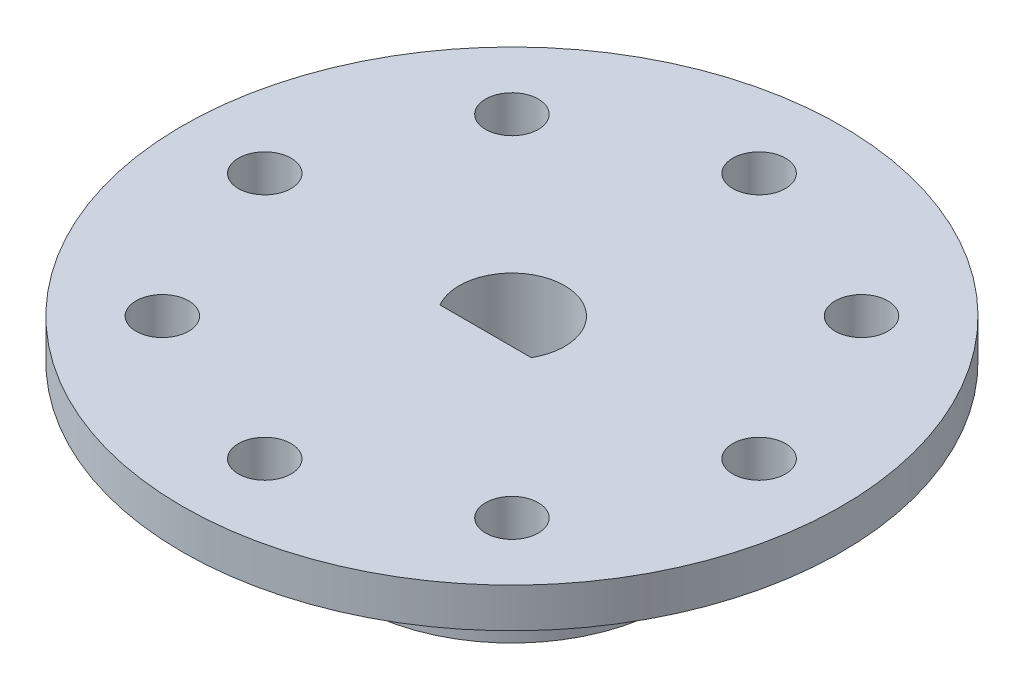
from build123d import *

# Parameters (mm, degrees)
SKETCH_1_R          = 25
SKETCH_1_R_2        = 2
EXTRUDE_1_DEPTH     = 3
SKETCH_2_R          = 12
EXTRUDE_2_DEPTH     = 10
CUT_EXTRUDE_1_DEPTH = 38.669616404
SKETCH_4_R          = 1.5
CUT_EXTRUDE_2_DEPTH = 39.13135193


with BuildPart() as part:
    # 草图1 → 凸台-拉伸1 (new body)
    with BuildSketch(Plane(origin=(0, 0, 0), x_dir=(1, 0, 0), z_dir=(0, 1, 0))):
        with Locations(Location((0, 0, 0), (0, 0, 270))):
            Circle(SKETCH_1_R)
        with Locations(Location((-18.75, 0, 0), (0, 0, 270))):
            Circle(SKETCH_1_R_2, mode=Mode.SUBTRACT)
        with Locations(Location((0, -18.75, 0), (0, 0, 90))):
            Circle(SKETCH_1_R_2, mode=Mode.SUBTRACT)
        with Locations(Location((-13.258252147, -13.258252147, 0), (0, 0, 270))):
            Circle(SKETCH_1_R_2, mode=Mode.SUBTRACT)
        with Locations(Location((0, 18.75, 0), (0, 0, 270))):
            Circle(SKETCH_1_R_2, mode=Mode.SUBTRACT)
        with Locations(Location((-13.258252147, 13.258252147, 0), (0, 0, 90))):
            Circle(SKETCH_1_R_2, mode=Mode.SUBTRACT)
        with Locations(Location((13.258252147, 13.258252147, 0), (0, 0, 270))):
            Circle(SKETCH_1_R_2, mode=Mode.SUBTRACT)
        with Locations(Location((18.75, 0, 0), (0, 0, 90))):
            Circle(SKETCH_1_R_2, mode=Mode.SUBTRACT)
        with Locations(Location((13.258252147, -13.258252147, 0), (0, 0, 90))):
            Circle(SKETCH_1_R_2, mode=Mode.SUBTRACT)
    extrude(amount=EXTRUDE_1_DEPTH)

    # 草图2 → 凸台-拉伸2 (add)
    with BuildSketch(Plane.XZ):
        with Locations(Location((0, 0, 0), (0, 0, 270))):
            Circle(SKETCH_2_R)
    extrude(amount=EXTRUDE_2_DEPTH)

    # 草图3 → 切除-拉伸1 (cut, through all)
    with BuildSketch(Plane.XZ.offset(10)):
        with BuildLine():
            Line((-3.464101615, 2), (3.464101615, 2))
            ThreePointArc((3.464101615, 2), (0, -4), (-3.464101615, 2))
        make_face()
    extrude(amount=-CUT_EXTRUDE_1_DEPTH, mode=Mode.SUBTRACT)

    # 草图4 → 切除-拉伸2 (cut, through all)
    with BuildSketch(Plane(origin=(0, 0, 2), x_dir=(-1, 0, 0), z_dir=(0, 0, -1))):
        with Locations((0, -5)):
            Circle(SKETCH_4_R)
    extrude(amount=-CUT_EXTRUDE_2_DEPTH, mode=Mode.SUBTRACT)


solid = part.part
